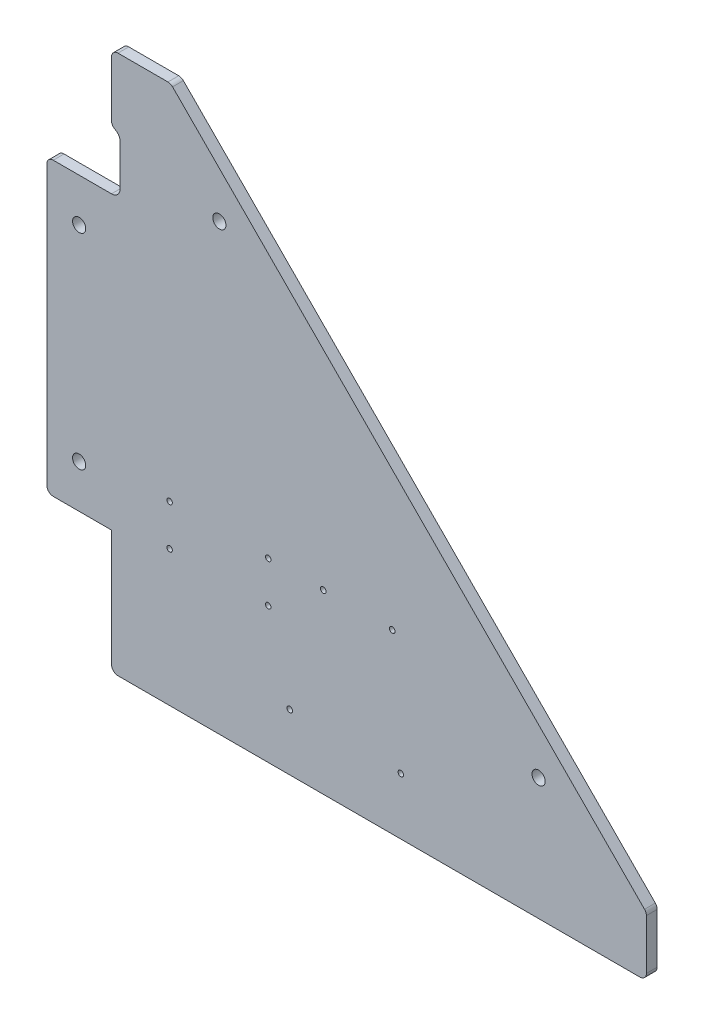
from build123d import *

# Parameters (mm, degrees)
SKETCH1_R           = 3.05
SKETCH1_R_2         = 1.27
BOSS_EXTRUDE1_DEPTH = 5
FILLET1_R           = 3
SKETCH2_R           = 1.3
CUT_EXTRUDE1_DEPTH  = 339.464178311


with BuildPart() as part:
    # Sketch1 → Boss-Extrude1 (new body)
    with BuildSketch(Plane.XY):
        with BuildLine():
            Line((0, 0), (0, 135))
            Line((0, 135), (30, 135))
            ThreePointArc((30, 135), (32.828427125, 136.171572875), (34, 139))
            Line((34, 139), (34, 158))
            ThreePointArc((34, 158), (32.828427125, 160.828427125), (30, 162))
            Line((30, 162), (30, 193))
            Line((30, 193), (57.43, 193))
            Line((57.43, 193), (278, -29.57))
            Line((278, -29.57), (278, -57))
            Line((278, -57), (30, -57))
            Line((30, -57), (30, 0))
            Line((30, 0), (0, 0))
        make_face()
        with Locations((15, 115)):
            Circle(SKETCH1_R, mode=Mode.SUBTRACT)
        with Locations((15, 20)):
            Circle(SKETCH1_R, mode=Mode.SUBTRACT)
        with Locations((80, 148.915753479)):
            Circle(SKETCH1_R, mode=Mode.SUBTRACT)
        with Locations((228, -0.426224125)):
            Circle(SKETCH1_R, mode=Mode.SUBTRACT)
        with Locations((56.935507079, 25)):
            Circle(SKETCH1_R_2, mode=Mode.SUBTRACT)
        with Locations((102.655507079, 25)):
            Circle(SKETCH1_R_2, mode=Mode.SUBTRACT)
        with Locations((102.655507079, 5.95)):
            Circle(SKETCH1_R_2, mode=Mode.SUBTRACT)
        with Locations((56.935507079, 5.95)):
            Circle(SKETCH1_R_2, mode=Mode.SUBTRACT)
    extrude(amount=BOSS_EXTRUDE1_DEPTH)

    # Fillet1
    fillet1_edges = [part.edges().sort_by_distance(p)[0] for p in [
        (30, 162, 2.5),
        (30, 193, 2.5),
        (57.43, 193, 2.5),
        (278, -29.57, 2.5),
        (278, -57, 2.5),
        (30, -57, 2.5),
        (0, 0, 2.5),
        (0, 135, 2.5),
    ]]
    fillet(fillet1_edges, radius=FILLET1_R)

    # Sketch2 → Cut-Extrude1 (cut, through all)
    with BuildSketch(Plane.XY.offset(5)):
        with Locations((112.655507079, -30.7)):
            Circle(SKETCH2_R)
        with Locations((164.155507079, -30.7)):
            Circle(SKETCH2_R)
        with Locations((128.155507079, 25)):
            Circle(SKETCH2_R)
        with Locations((160.155507079, 25)):
            Circle(SKETCH2_R)
    extrude(amount=-CUT_EXTRUDE1_DEPTH, mode=Mode.SUBTRACT)


solid = part.part
